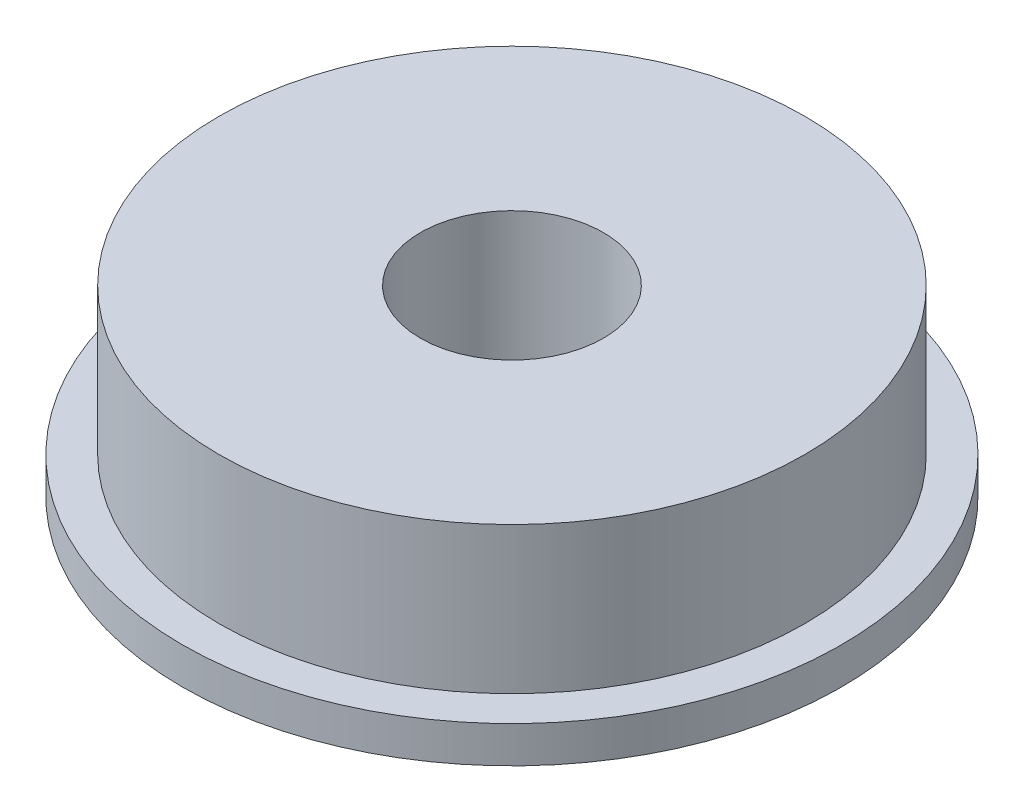
from build123d import *

# Parameters (mm, degrees)
SKETCH_1_R      = 9
SKETCH_1_R_2    = 2.5
EXTRUDE_1_DEPTH = 1
SKETCH_2_R      = 8
SKETCH_2_R_2    = 2.5
EXTRUDE_2_DEPTH = 4


with BuildPart() as part:
    # Эскиз1 → Бобышка-Вытянуть1 (new body)
    with BuildSketch(Plane(origin=(0, 0, 0), x_dir=(1, 0, 0), z_dir=(0, 1, 0))):
        with Locations(Location((0, 0, 0), (0, 0, 270))):
            Circle(SKETCH_1_R)
        with Locations(Location((0, 0, 0), (0, 0, 270))):
            Circle(SKETCH_1_R_2, mode=Mode.SUBTRACT)
    extrude(amount=EXTRUDE_1_DEPTH)

    # Эскиз2 → Бобышка-Вытянуть2 (add)
    with BuildSketch(Plane(origin=(0, 1, 0), x_dir=(1, 0, 0), z_dir=(0, 1, 0))):
        with Locations(Location((0, 0, 0), (0, 0, 270))):
            Circle(SKETCH_2_R)
        with Locations(Location((0, 0, 0), (0, 0, 270))):
            Circle(SKETCH_2_R_2, mode=Mode.SUBTRACT)
    extrude(amount=EXTRUDE_2_DEPTH)


solid = part.part
